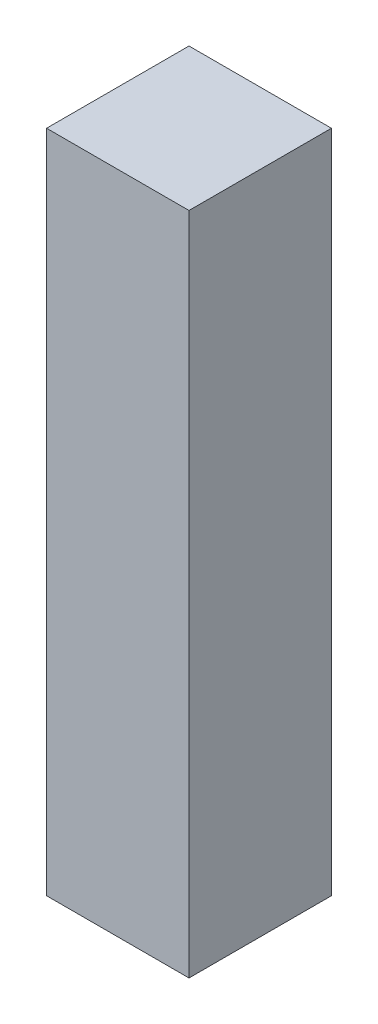
from build123d import *

# Parameters (mm, degrees)
SKETCH1_W           = 150
SKETCH1_H           = 150
BOSS_EXTRUDE1_DEPTH = 700


with BuildPart() as part:
    # Sketch1 → Boss-Extrude1 (new body)
    with BuildSketch(Plane(origin=(0, 0, 0), x_dir=(1, 0, 0), z_dir=(0, 1, 0))):
        with Locations((-48.820754717, -88.443396226)):
            Rectangle(SKETCH1_W, SKETCH1_H)
    extrude(amount=BOSS_EXTRUDE1_DEPTH)


solid = part.part
